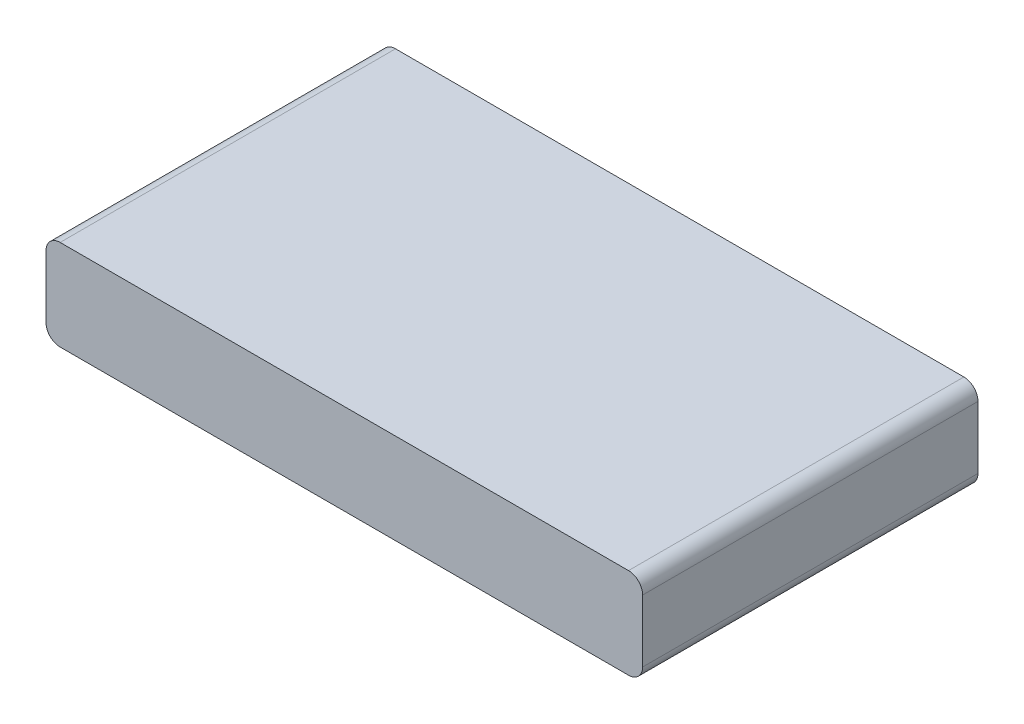
from build123d import *

# Parameters (mm, degrees)
SKETCH1_W           = 126.75
SKETCH1_H           = 71.25
BOSS_EXTRUDE1_DEPTH = 19.25
FILLET2_R           = 3


with BuildPart() as part:
    # Sketch1 → Boss-Extrude1 (new body)
    with BuildSketch(Plane(origin=(0, 0, 0), x_dir=(1, 0, 0), z_dir=(0, 1, 0))):
        with Locations((63.375, 35.625)):
            Rectangle(SKETCH1_W, SKETCH1_H)
    extrude(amount=BOSS_EXTRUDE1_DEPTH)

    # Fillet2
    fillet2_edges = [part.edges().sort_by_distance(p)[0] for p in [
        (126.75, 19.25, -35.625),
        (0, 19.25, -35.625),
        (126.75, 0, -35.625),
        (0, 0, -35.625),
    ]]
    fillet(fillet2_edges, radius=FILLET2_R)


solid = part.part
